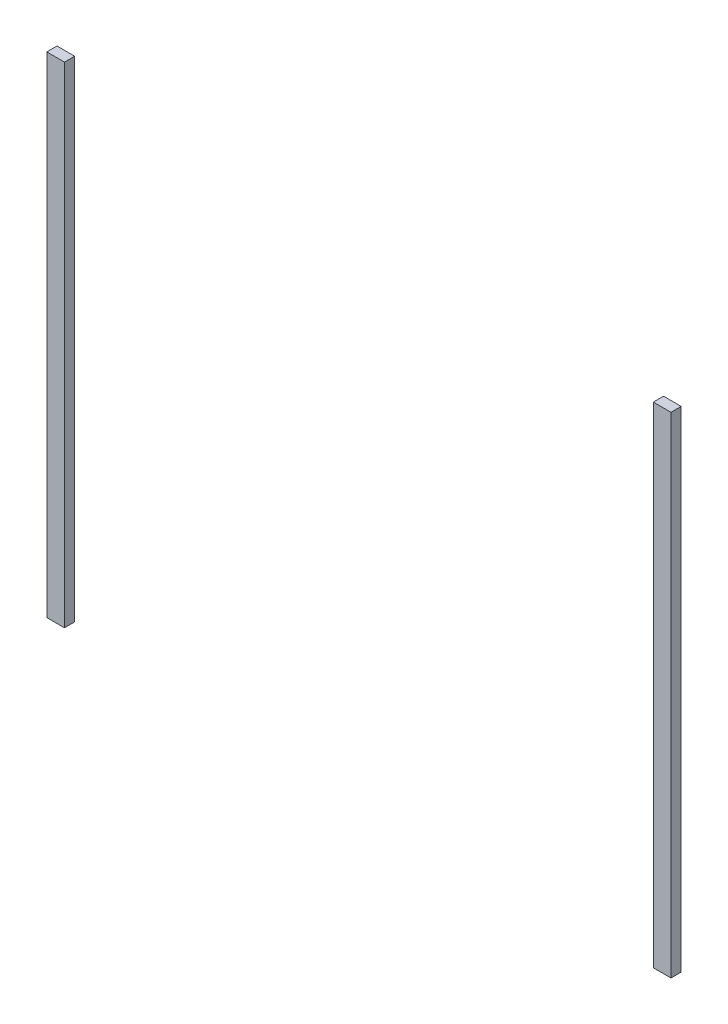
from build123d import *

# Parameters (mm, degrees)
SKETCH1_W             = 21.997045256
SKETCH1_H             = 12.7
BOSS_EXTRUDE1_DEPTH   = 609.6
BOSS_EXTRUDE1_2_DEPTH = 609.6


with BuildPart() as part:
    # Sketch1 → Boss-Extrude1 (new body)
    with BuildSketch(Plane(origin=(0, 609.6, 0), x_dir=(1, 0, 0), z_dir=(0, 1, 0))):
        with Locations((377.333825791, -653.561357684)):
            Rectangle(SKETCH1_W, SKETCH1_H)
    extrude(amount=-BOSS_EXTRUDE1_DEPTH)


with BuildPart() as body_2:
    # Sketch1 → Boss-Extrude1 2 (new body)
    with BuildSketch(Plane(origin=(0, 609.6, 0), x_dir=(1, 0, 0), z_dir=(0, 1, 0))):
        with Locations((-377.333825791, -653.561357684)):
            Rectangle(SKETCH1_W, SKETCH1_H)
    extrude(amount=-BOSS_EXTRUDE1_2_DEPTH)


solid = Compound([part.part, body_2.part])
